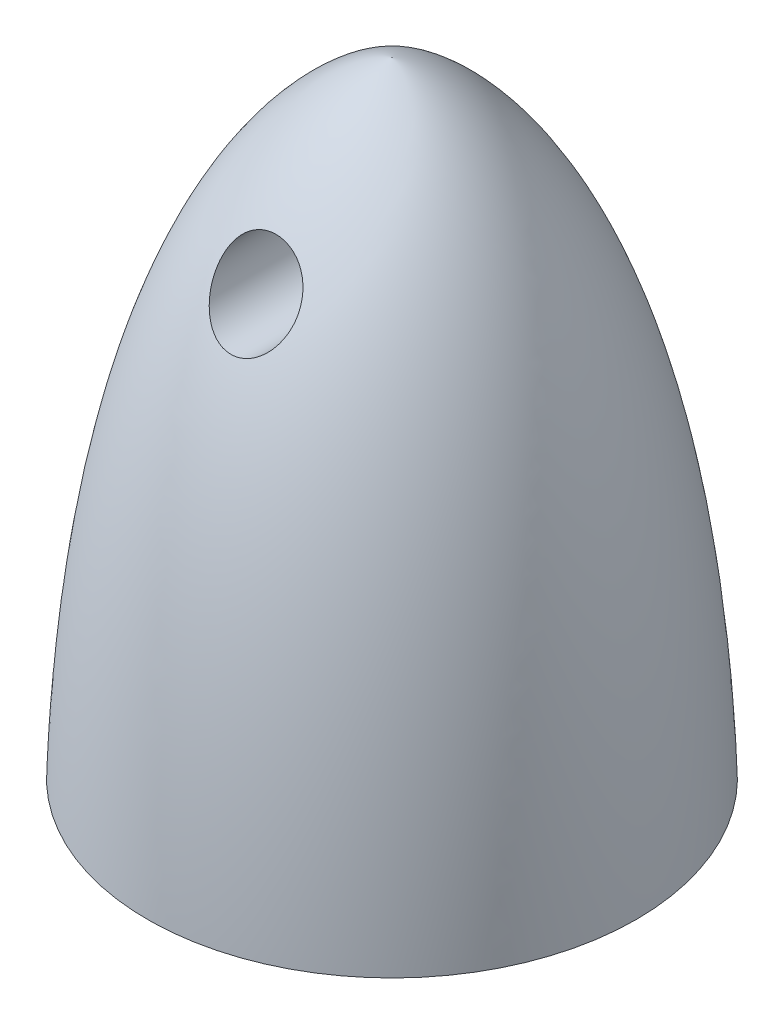
from build123d import *

# Parameters (mm, degrees)
CUT_EXTRUDE1_DEPTH = 7
SKETCH4_R          = 1.5
CUT_EXTRUDE2_DEPTH = 8.5
CHAMFER1_SIZE      = 0.5
FILLET1_R          = 0.5


with BuildPart() as part:
    # Sketch1 → Revolve1 (revolve)
    with BuildSketch(Plane.XY):
        with BuildLine():
            Line((3.5, 3.528396461), (3.5, 0))
            Line((3.5, 0), (9, 0))
            add(Edge.make_bspline(
                [(0, 23), (0.037336166, 22.983975753), (8.262108542, 21.480183495), (9, 0)],
                knots=[0, 0, 0, 0, 1, 1, 1, 1], degree=3))
            Line((0, 23), (0, 14))
            Line((0, 14), (3.5, 14))
            Line((3.5, 14), (3.5, 3.528396461))
        make_face()
    revolve(axis=Axis((0, 0, 0), (0, 1, 0)))

    # Sketch2 → Cut-Extrude1 (cut)
    with BuildSketch(Plane(origin=(0, 0, 0), x_dir=(1, 0, 0), z_dir=(0, 1, 0))):
        Polygon((5.629165125, 0), (2.814582562, 4.875), (-2.814582562, 4.875), (-5.629165125, 0), (-2.814582562, -4.875), (2.814582562, -4.875), align=None)
    extrude(amount=CUT_EXTRUDE1_DEPTH, mode=Mode.SUBTRACT)

    # Sketch4 → Cut-Extrude2 (cut, symmetric)
    with BuildSketch(Plane.XY):
        with Locations((0, 18)):
            Circle(SKETCH4_R)
    extrude(amount=CUT_EXTRUDE2_DEPTH, both=True, mode=Mode.SUBTRACT)

    # Chamfer1
    chamfer1_edges = [part.edges().sort_by_distance(p)[0] for p in [
        (4.221873843, 0, 2.4375),
        (4.221873843, 0, -2.4375),
        (0, 0, -4.875),
        (-4.221873843, 0, -2.4375),
        (-4.221873843, 0, 2.4375),
        (0, 0, 4.875),
    ]]
    chamfer(chamfer1_edges, length=CHAMFER1_SIZE)

    # Fillet1
    fillet1_edges = [part.edges().sort_by_distance(p)[0] for p in [
        (-3.5, 7, 0),
        (-3.5, 14, 0),
    ]]
    fillet(fillet1_edges, radius=FILLET1_R)


solid = part.part
